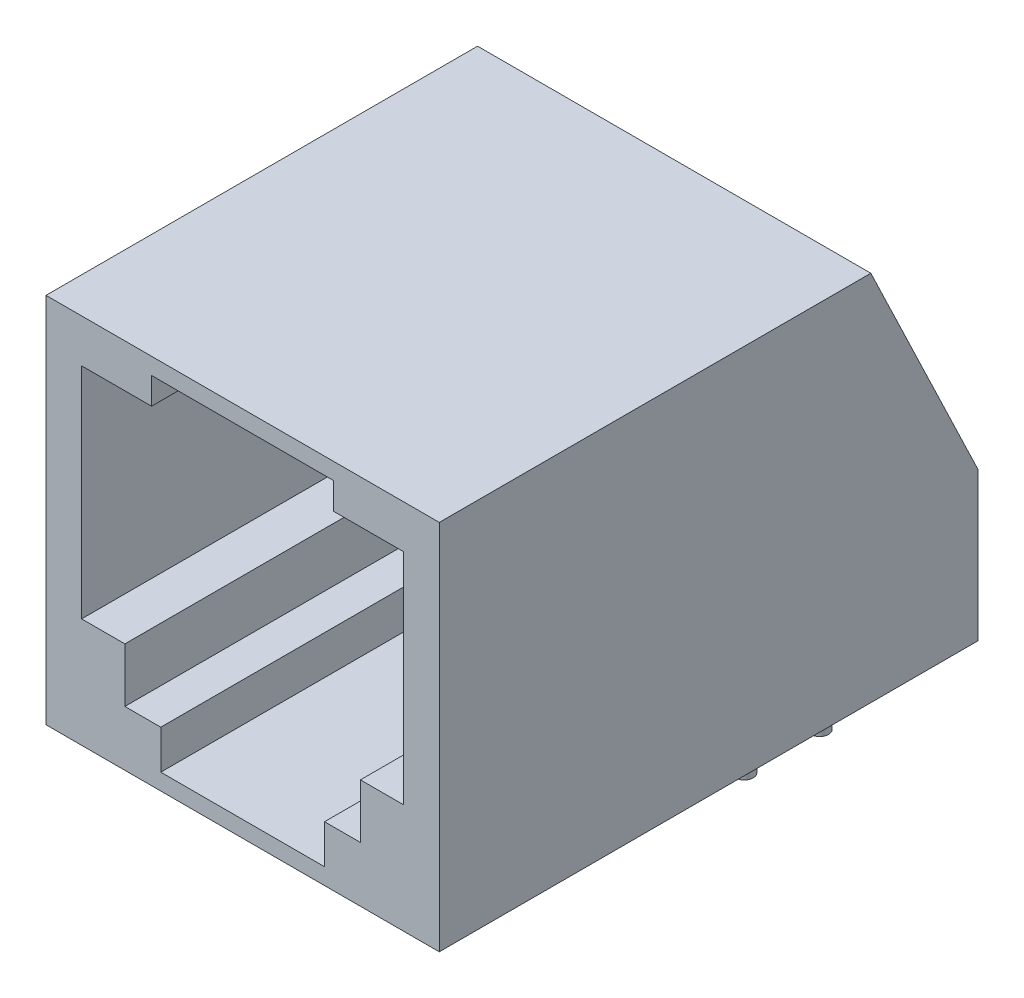
from build123d import *

# Parameters (mm, degrees)
BOSS_EXTRUDE1_DEPTH = 6.625
CUT_EXTRUDE1_DEPTH  = 13.25
SKETCH3_R           = 0.3
BOSS_EXTRUDE2_DEPTH = 4


with BuildPart() as part:
    # Sketch1 → Boss-Extrude1 (new, symmetric)
    with BuildSketch(Plane(origin=(0, 0, 0), x_dir=(0, 0, -1), z_dir=(1, 0, 0))):
        Polygon((0, 0), (0, 12.53), (14.54, 12.53), (18.15, 5), (18.15, 0), align=None)
    extrude(amount=BOSS_EXTRUDE1_DEPTH, both=True)

    # Sketch2 → Cut-Extrude1 (cut)
    with BuildSketch(Plane.XY):
        Polygon((-2.758412662, 1.863268477), (-2.758412662, 0.55), (2.758412662, 0.55), (2.758412662, 1.863268477), (3.967697722, 1.863268477), (3.967697722, 3.689249531), (5.425, 3.689249531), (5.425, 11.073209492), (3.069315997, 11.073209492), (3.069315997, 11.97), (-3.069315997, 11.97), (-3.069315997, 11.073209492), (-5.425, 11.073209492), (-5.425, 3.689249531), (-3.967697722, 3.689249531), (-3.967697722, 1.863268477), align=None)
    extrude(amount=-CUT_EXTRUDE1_DEPTH, mode=Mode.SUBTRACT)

    # Sketch3 → Boss-Extrude2 (add)
    with BuildSketch(Plane.XZ):
        with Locations(Location((2.54, -16.9, 0), (0, 0, 270))):
            Circle(SKETCH3_R)
        with Locations(Location((0, -16.9, 0), (0, 0, 270))):
            Circle(SKETCH3_R)
        with Locations(Location((-2.54, -16.9, 0), (0, 0, 270))):
            Circle(SKETCH3_R)
        with Locations(Location((0, -14.36, 0), (0, 0, 270))):
            Circle(SKETCH3_R)
        with Locations(Location((-2.54, -14.36, 0), (0, 0, 270))):
            Circle(SKETCH3_R)
        with Locations(Location((2.54, -14.36, 0), (0, 0, 270))):
            Circle(SKETCH3_R)
    extrude(amount=BOSS_EXTRUDE2_DEPTH)


solid = part.part
